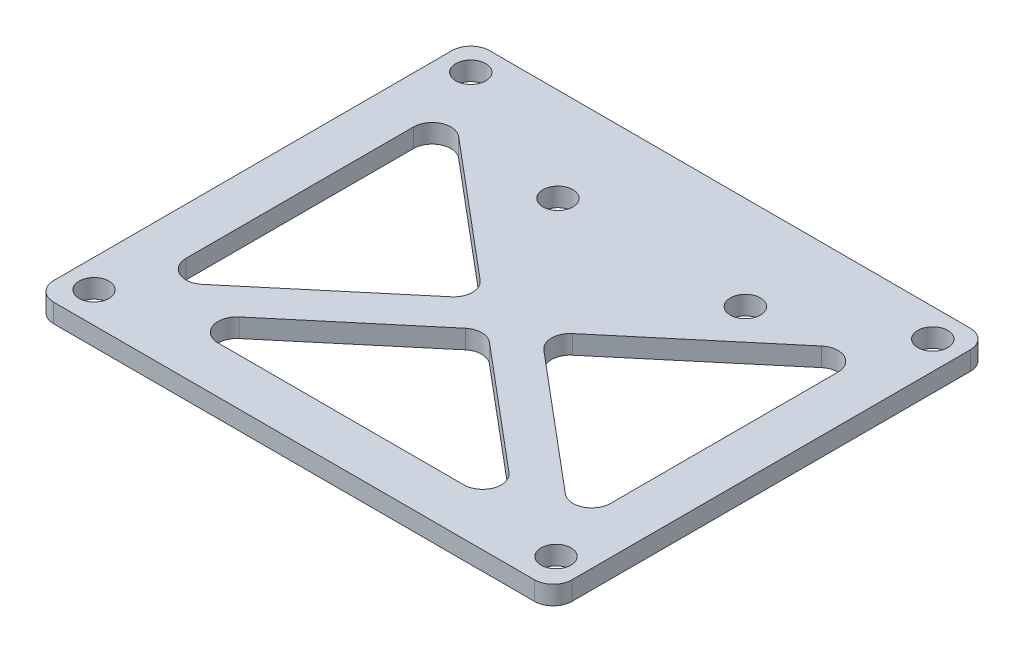
from build123d import *

# Parameters (mm, degrees)
SKETCH_1_W      = 55.3
SKETCH_1_H      = 46.5
SKETCH_1_R      = 1.6
EXTRUDE_1_DEPTH = 2
FILLET_1_R      = 2


with BuildPart() as part:
    # 草图1 → 凸台-拉伸1 (new body)
    with BuildSketch(Plane(origin=(0, 0, 0), x_dir=(1, 0, 0), z_dir=(0, 1, 0))):
        Rectangle(SKETCH_1_W, SKETCH_1_H)
        with Locations(Location((11.65, 13.25, 0), (0, 0, 270))):
            Circle(SKETCH_1_R, mode=Mode.SUBTRACT)
        with Locations(Location((-8.35, 13.25, 0), (0, 0, 270))):
            Circle(SKETCH_1_R, mode=Mode.SUBTRACT)
        with Locations(Location((24.65, 20.25, 0), (0, 0, 270))):
            Circle(SKETCH_1_R, mode=Mode.SUBTRACT)
        with Locations(Location((-24.65, 20.25, 0), (0, 0, 270))):
            Circle(SKETCH_1_R, mode=Mode.SUBTRACT)
        with Locations(Location((-24.65, -19.95, 0), (0, 0, 270))):
            Circle(SKETCH_1_R, mode=Mode.SUBTRACT)
        with Locations(Location((24.65, -19.95, 0), (0, 0, 270))):
            Circle(SKETCH_1_R, mode=Mode.SUBTRACT)
        Polygon((-3.107609479, 0), (-22.65, 16.432570691), (-22.65, -16.432570691), align=None, mode=Mode.SUBTRACT)
        Polygon((0, -2.613089345), (-18.596153962, -18.25), (18.596153962, -18.25), align=None, mode=Mode.SUBTRACT)
        Polygon((3.107609479, 0), (22.65, 16.432570691), (22.65, -16.432570691), align=None, mode=Mode.SUBTRACT)
    extrude(amount=EXTRUDE_1_DEPTH)

    # 圆角1
    fillet_1_edges = [part.edges().sort_by_distance(p)[0] for p in [
        (-22.65, 1, 16.432570691),
        (-3.107609479, 1, 0),
        (-22.65, 1, -16.432570691),
        (18.596153962, 1, 18.25),
        (0, 1, 2.613089345),
        (-18.596153962, 1, 18.25),
        (3.107609479, 1, 0),
        (22.65, 1, 16.432570691),
        (22.65, 1, -16.432570691),
        (27.65, 1, 23.25),
        (-27.65, 1, 23.25),
        (-27.65, 1, -23.25),
        (27.65, 1, -23.25),
    ]]
    fillet(fillet_1_edges, radius=FILLET_1_R)


solid = part.part
